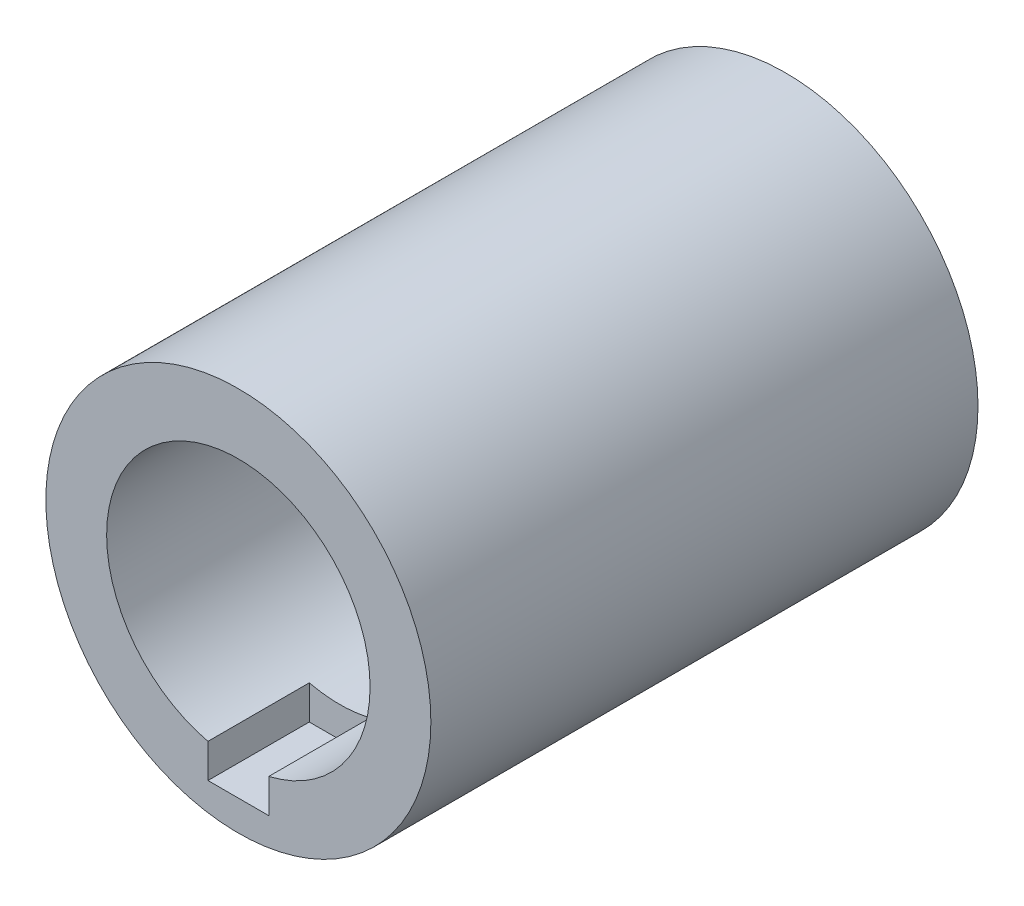
from build123d import *

# Parameters (mm, degrees)
SKETCH1_R               = 9.5
SKETCH1_R_2             = 6.5
BOSS_EXTRUDE1_DEPTH     = 13.5
CUT_EXTRUDE1_REACH      = 29.046
CUT_EXTRUDE1_END_RADIUS = 6.5
CUT_EXTRUDE1_START      = -8
SKETCH2_W               = 3
SKETCH2_H               = 5


with BuildPart() as part:
    # Sketch1 → Boss-Extrude1 (new, symmetric)
    with BuildSketch(Plane.XY):
        Circle(SKETCH1_R)
        Circle(SKETCH1_R_2, mode=Mode.SUBTRACT)
    extrude(amount=BOSS_EXTRUDE1_DEPTH, both=True)

    # Cut-Extrude1: up to this cylinder (the profile starts outside it)
    cut_extrude1_end = Plane(origin=(0, 0, 11), z_dir=(0, 0, -1)) * Cylinder(CUT_EXTRUDE1_END_RADIUS, 72.092, mode=Mode.PRIVATE)
    # Sketch2 → Cut-Extrude1 (cut, up to the surface)
    with BuildSketch(Plane(origin=(0, 0, 0), x_dir=(1, 0, 0), z_dir=(0, 1, 0)).offset(CUT_EXTRUDE1_START), mode=Mode.PRIVATE) as cut_extrude1_sk1:
        with Locations((0, -11)):
            Rectangle(SKETCH2_W, SKETCH2_H)
    cut_extrude1_tool1 = extrude(cut_extrude1_sk1.sketch, amount=CUT_EXTRUDE1_REACH, mode=Mode.PRIVATE) - cut_extrude1_end
    add(cut_extrude1_tool1.solids().sort_by_distance((0, -8, 11))[0], mode=Mode.SUBTRACT)


solid = part.part
